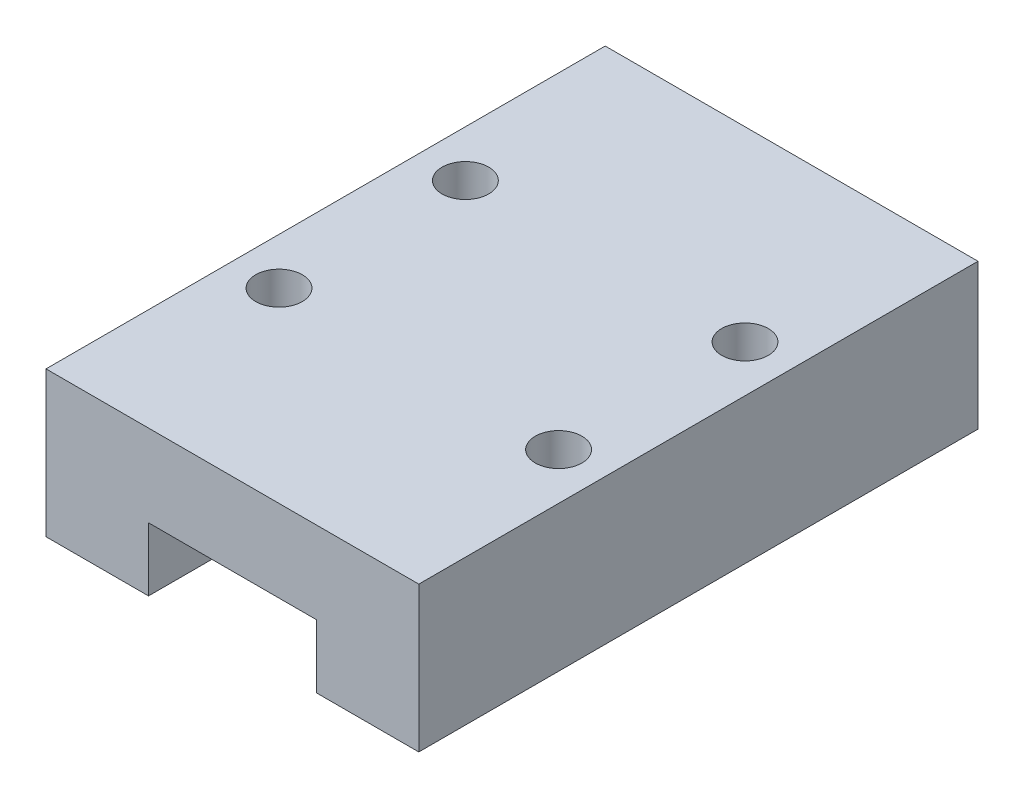
from build123d import *

# Parameters (mm, degrees)
BOSS_EXTRU_1_DEPTH      = 30
ESQUISSE2_R             = 1.25
ENL_V_MAT_EXTRU_1_DEPTH = 2.6


with BuildPart() as part:
    # Esquisse1 → Boss.-Extru.1 (new body)
    with BuildSketch(Plane.XY):
        Polygon((0, 0), (0, 7.8), (20, 7.8), (20, 0), (14.5, 0), (14.5, 3.4), (5.5, 3.4), (5.5, 0), align=None)
    extrude(amount=BOSS_EXTRU_1_DEPTH)

    # Esquisse2 → Enlèv. mat.-Extru.1 (cut)
    with BuildSketch(Plane(origin=(0, 7.8, 0), x_dir=(1, 0, 0), z_dir=(0, 1, 0))):
        with Locations(Location((2.5, -10, 0), (0, 0, 270))):
            Circle(ESQUISSE2_R)
        with Locations(Location((17.5, -10, 0), (0, 0, 270))):
            Circle(ESQUISSE2_R)
        with Locations(Location((17.5, -20, 0), (0, 0, 270))):
            Circle(ESQUISSE2_R)
        with Locations(Location((2.5, -20, 0), (0, 0, 270))):
            Circle(ESQUISSE2_R)
    extrude(amount=-ENL_V_MAT_EXTRU_1_DEPTH, mode=Mode.SUBTRACT)


solid = part.part
